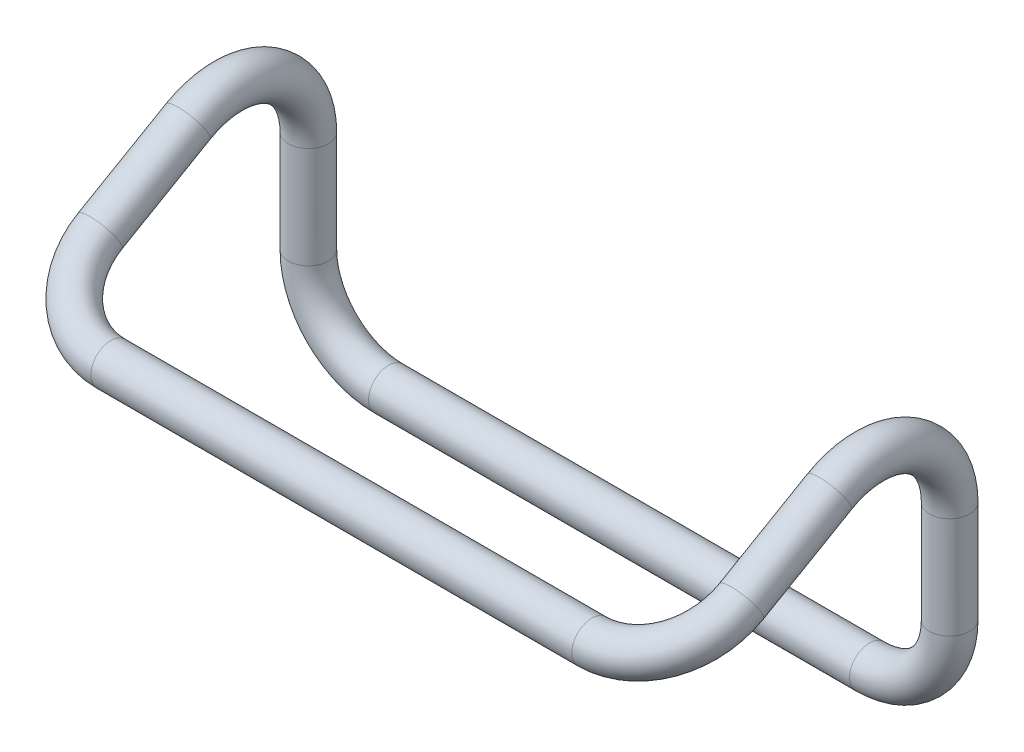
from build123d import *

# Parameters (mm, degrees)
SWEEP_3_PROFILE_R = 5


with BuildPart() as part:
    # 扫描3: sweep along a curve in space
    with BuildLine() as sweep_3_path:
        Line((20, 0, 0), (140, 0, 0))
        ThreePointArc((140, 0, 0), (154.142135624, 2.928932188, -5.073059362), (160, 10, -17.320508076))
        Line((160, 10, -17.320508076), (160, 22.679491924, -39.282032303))
        ThreePointArc((160, 22.679491924, -39.282032303), (160, 22.679491924, -59.282032303), (160, 5.358983849, -69.282032303))
        Line((160, 5.358983849, -69.282032303), (160, -20, -69.282032303))
        ThreePointArc((160, -20, -69.282032303), (154.142135624, -34.142135624, -69.282032303), (140, -40, -69.282032303))
        Line((140, -40, -69.282032303), (20, -40, -69.282032303))
        ThreePointArc((20, -40, -69.282032303), (5.857864376, -34.142135624, -69.282032303), (0, -20, -69.282032303))
        Line((0, -20, -69.282032303), (0, 5.358983849, -69.282032303))
        ThreePointArc((0, 5.358983849, -69.282032303), (0, 22.679491924, -59.282032303), (0, 22.679491924, -39.282032303))
        Line((0, 22.679491924, -39.282032303), (0, 10, -17.320508076))
        ThreePointArc((20, 0, 0), (5.857864376, 2.928932188, -5.073059362), (0, 10, -17.320508076))
    # 扫描3 profile (on start of the path) → 扫描3 (sweep)
    with BuildSketch(Plane.YZ.offset(20)):
        Circle(SWEEP_3_PROFILE_R)
    sweep(path=sweep_3_path.line)


solid = part.part
